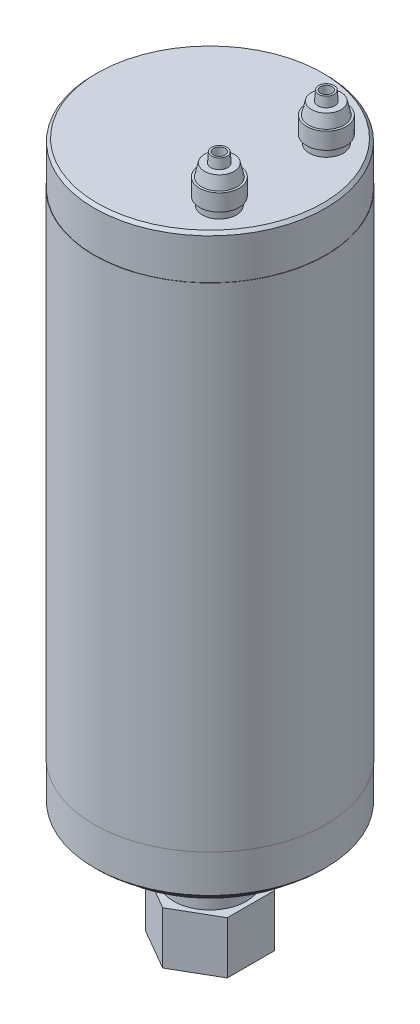
from build123d import *

# Parameters (mm, degrees)
SKETCH2_R           = 12.5
BOSS_EXTRUDE1_DEPTH = 12.72
CHAMFER1_SIZE       = 1
BOSS_EXTRUDE2_DEPTH = 18


with BuildPart() as part:
    # Sketch1 → Revolve1 (revolve)
    with BuildSketch(Plane(origin=(0, 0, 0), x_dir=(0, 0, -1), z_dir=(1, 0, 0))):
        Polygon((0, 104.5), (0, -104.5), (-19.925, -104.5), (-21.965, -98.5), (-35, -98.5), (-35, -94.5), (-39.9, -94.5), (-39.9, -80.5), (-40, -80.5), (-40, 89.5), (-39.9, 89.5), (-39.9, 104.5), align=None)
    revolve(axis=Axis((0, 104.5, 0), (0, -1, 0)))

    # Sketch2 → Boss-Extrude1 (add)
    with BuildSketch(Plane.XZ.offset(104.5)):
        with Locations(Location((0, 0, 0), (0, 0, 90))):
            Circle(SKETCH2_R)
    extrude(amount=BOSS_EXTRUDE1_DEPTH)

    # Chamfer1
    chamfer1_edges = [part.edges().sort_by_distance(p)[0] for p in [
        (0, -98.5, -35),
        (0, -94.5, -39.9),
        (0, 104.5, -39.9),
    ]]
    chamfer(chamfer1_edges, length=CHAMFER1_SIZE)

    # Sketch3 → Boss-Extrude2 (add)
    with BuildSketch(Plane.XZ.offset(117.22)):
        Polygon((0, 16.310145105), (-14.125, 8.155072552), (-14.125, -8.155072552), (0, -16.310145105), (14.125, -8.155072552), (14.125, 8.155072552), align=None)
    extrude(amount=BOSS_EXTRUDE2_DEPTH)

    # Sketch4 → Revolve2 (revolve)
    with BuildSketch(Plane(origin=(0, 0, 0), x_dir=(0, 0, -1), z_dir=(1, 0, 0)), mode=Mode.PRIVATE) as revolve2_sk:
        Polygon((-6, -135.22), (-6, -139.22), (-8, -139.22), (-12, -135.22), align=None)
    revolve(revolve2_sk.sketch.rotate(Axis((0, 258.155027854, 0), (0, -1, 0)), 180), axis=Axis((0, 258.155027854, 0), (0, -1, 0)))

    # Sketch6 → Revolve3 (revolve)
    with BuildSketch(Plane(origin=(21.67, 0, 0), x_dir=(0, 0, -1), z_dir=(1, 0, 0))):
        Polygon((20.45, 104.5), (24.3, 104.5), (24.3, 107.26), (25.275, 107.26), (25.275, 113.02), (24.54, 113.02), (23.56, 117.19), (21.355, 117.19), (21.11, 120.5), (20.45, 120.5), align=None)
    revolve3 = revolve(axis=Axis((21.67, 104.5, -18.45), (0, 1, 0)))

    # Mirror1: Revolve3 across plane
    add(revolve3.mirror(Plane.XY))


solid = part.part
